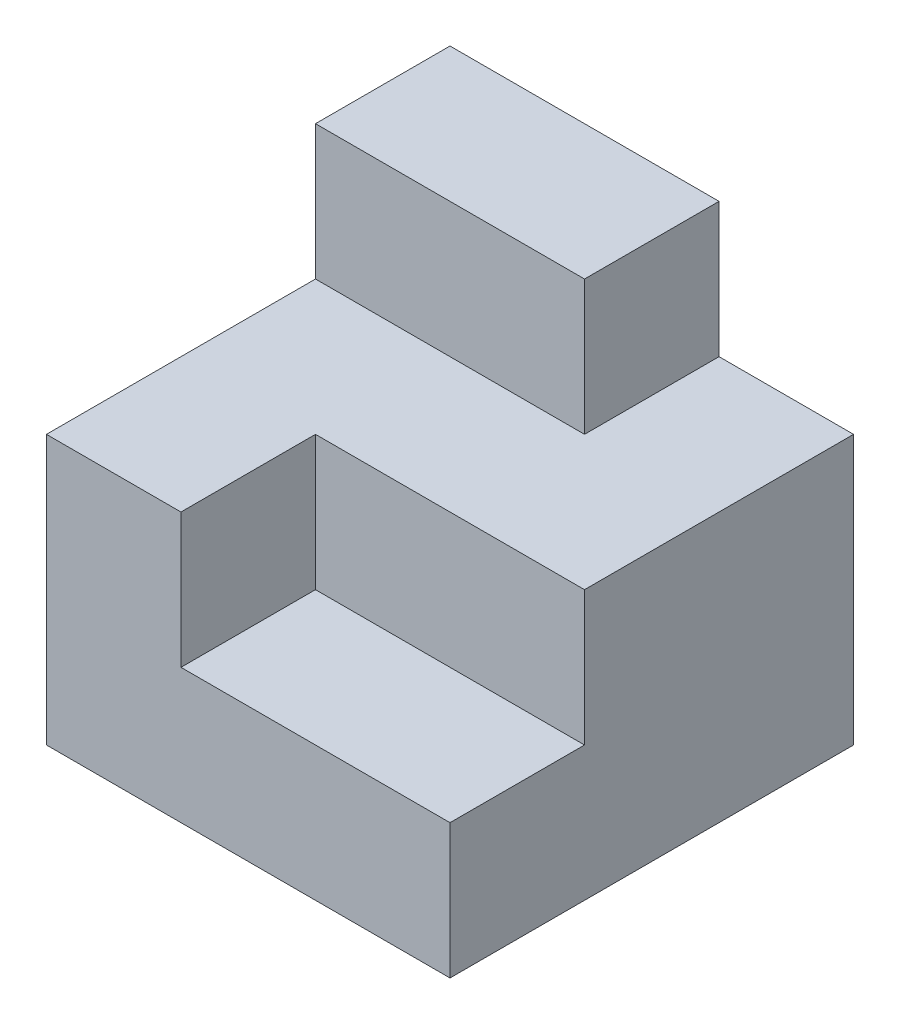
from build123d import *

# Parameters (mm, degrees)
CROQUIS1_W              = 30
CROQUIS1_H              = 30
SALIENTE_EXTRUIR1_DEPTH = 10
SALIENTE_EXTRUIR2_DEPTH = 10
CROQUIS5_W              = 20
CROQUIS5_H              = 10
SALIENTE_EXTRUIR3_DEPTH = 10


with BuildPart() as part:
    # Croquis1 → Saliente-Extruir1 (new body)
    with BuildSketch(Plane(origin=(0, 0, 0), x_dir=(1, 0, 0), z_dir=(0, 1, 0))):
        with Locations((-101.786127258, 14.977187745)):
            Rectangle(CROQUIS1_W, CROQUIS1_H)
    extrude(amount=SALIENTE_EXTRUIR1_DEPTH)

    # Croquis3 → Saliente-Extruir2 (add)
    with BuildSketch(Plane(origin=(0, 10, 0), x_dir=(1, 0, 0), z_dir=(0, 1, 0))):
        Polygon((-116.786127258, 29.977187745), (-106.786127258, 29.977187745), (-86.786127258, 29.977187745), (-86.786127258, 9.977187745), (-106.786127258, 9.977187745), (-106.786127258, -0.022812255), (-116.786127258, -0.022812255), align=None)
    extrude(amount=SALIENTE_EXTRUIR2_DEPTH)

    # Croquis5 → Saliente-Extruir3 (add)
    with BuildSketch(Plane(origin=(0, 20, 0), x_dir=(1, 0, 0), z_dir=(0, 1, 0))):
        with Locations((-106.786127258, 24.977187745)):
            Rectangle(CROQUIS5_W, CROQUIS5_H)
    extrude(amount=SALIENTE_EXTRUIR3_DEPTH)


solid = part.part
